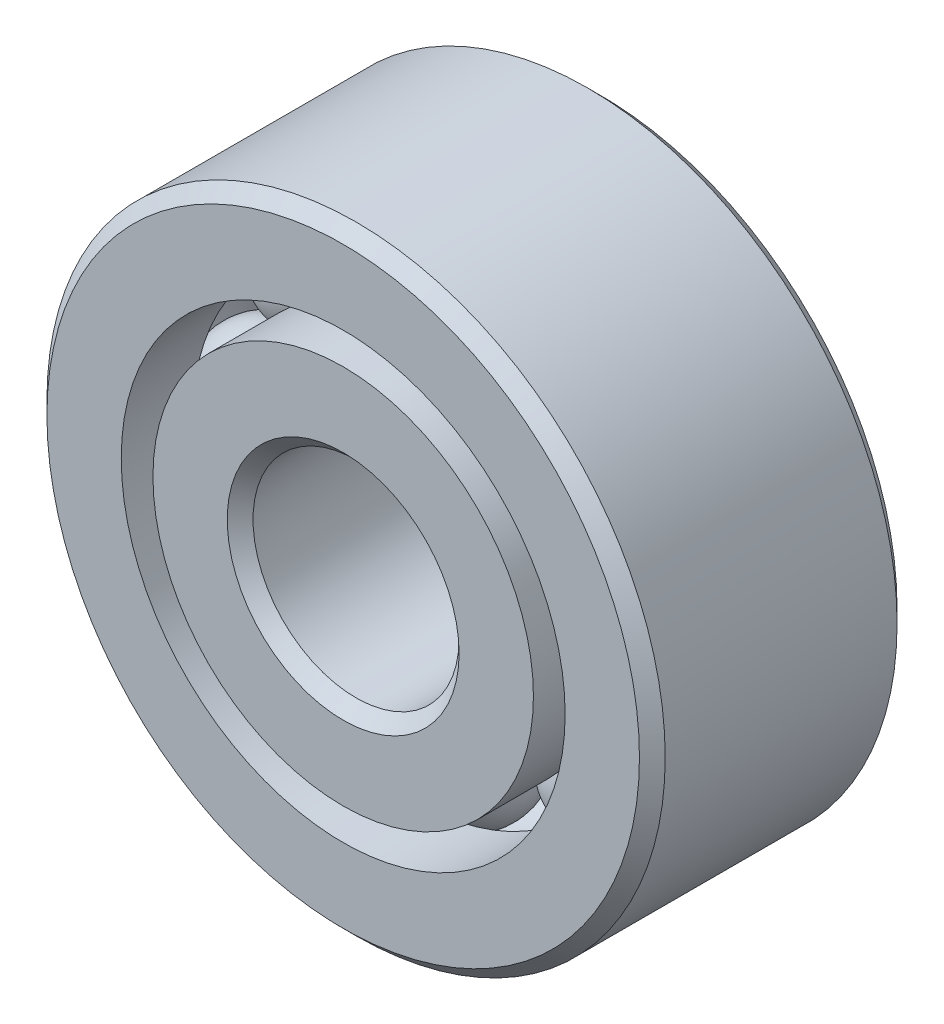
from build123d import *

# Parameters (mm, degrees)
CIRPATTERN1_COUNT = 8


with BuildPart() as part:
    # Sketch1 → Revolve1 (revolve)
    with BuildSketch(Plane(origin=(0, 0, 0), x_dir=(0, 0, -1), z_dir=(1, 0, 0))):
        with BuildLine():
            Line((1.7859375, 4.7625), (-1.7859375, 4.7625))
            Line((-1.7859375, 4.7625), (-1.984375, 4.5640625))
            Line((-1.984375, 4.5640625), (-1.984375, 3.419230769))
            Line((-1.984375, 3.419230769), (-0.881944444, 3.419230769))
            ThreePointArc((-0.881944444, 3.419230769), (0, 4.090136422), (0.881944444, 3.419230769))
            Line((0.881944444, 3.419230769), (1.984375, 3.419230769))
            Line((1.984375, 3.419230769), (1.984375, 4.5640625))
            Line((1.984375, 4.5640625), (1.7859375, 4.7625))
        make_face()
    revolve(axis=Axis((0, 0, 1.984375), (0, 0, -1)))


with BuildPart() as body_2:
    # Sketch3 → Revolve3 (revolve)
    with BuildSketch(Plane(origin=(0, 0, 0), x_dir=(0, 0, -1), z_dir=(1, 0, 0))):
        with BuildLine():
            Line((-1.984375, 2.930769231), (-0.881944444, 2.930769231))
            ThreePointArc((-0.881944444, 2.930769231), (0, 2.259863578), (0.881944444, 2.930769231))
            Line((0.881944444, 2.930769231), (1.984375, 2.930769231))
            Line((1.984375, 2.930769231), (1.984375, 1.7859375))
            Line((1.984375, 1.7859375), (1.7859375, 1.5875))
            Line((1.7859375, 1.5875), (-1.7859375, 1.5875))
            Line((-1.7859375, 1.5875), (-1.984375, 1.7859375))
            Line((-1.984375, 1.7859375), (-1.984375, 2.930769231))
        make_face()
    revolve(axis=Axis((0, 0, 1.984375), (0, 0, -1)))


with BuildPart() as body_3:
    # Sketch4 → Revolve4 (revolve)
    with BuildSketch(Plane(origin=(0, 0, 0), x_dir=(0, 0, -1), z_dir=(1, 0, 0))):
        with BuildLine():
            Line((-0.915136422, 3.175), (0.915136422, 3.175))
            ThreePointArc((0.915136422, 3.175), (0, 4.090136422), (-0.915136422, 3.175))
        make_face()
    revolve(axis=Axis((0, 3.175, 0.915136422), (0, 0, -1)))


with BuildPart() as cirpattern1_1:
    # CirPattern1: pattern copy
    add(body_3.part.rotate(Axis((0, 0, -1.984375), (0, 0, 1)), 1 * 360 / CIRPATTERN1_COUNT))


with BuildPart() as cirpattern1_2:
    # CirPattern1: pattern copy
    add(body_3.part.rotate(Axis((0, 0, -1.984375), (0, 0, 1)), 2 * 360 / CIRPATTERN1_COUNT))


with BuildPart() as cirpattern1_3:
    # CirPattern1: pattern copy
    add(body_3.part.rotate(Axis((0, 0, -1.984375), (0, 0, 1)), 3 * 360 / CIRPATTERN1_COUNT))


with BuildPart() as cirpattern1_4:
    # CirPattern1: pattern copy
    add(body_3.part.rotate(Axis((0, 0, -1.984375), (0, 0, 1)), 4 * 360 / CIRPATTERN1_COUNT))


with BuildPart() as cirpattern1_5:
    # CirPattern1: pattern copy
    add(body_3.part.rotate(Axis((0, 0, -1.984375), (0, 0, 1)), 5 * 360 / CIRPATTERN1_COUNT))


with BuildPart() as cirpattern1_6:
    # CirPattern1: pattern copy
    add(body_3.part.rotate(Axis((0, 0, -1.984375), (0, 0, 1)), 6 * 360 / CIRPATTERN1_COUNT))


with BuildPart() as cirpattern1_7:
    # CirPattern1: pattern copy
    add(body_3.part.rotate(Axis((0, 0, -1.984375), (0, 0, 1)), 7 * 360 / CIRPATTERN1_COUNT))


solid = Compound([part.part, body_2.part, body_3.part, cirpattern1_1.part, cirpattern1_2.part, cirpattern1_3.part, cirpattern1_4.part, cirpattern1_5.part, cirpattern1_6.part, cirpattern1_7.part])
